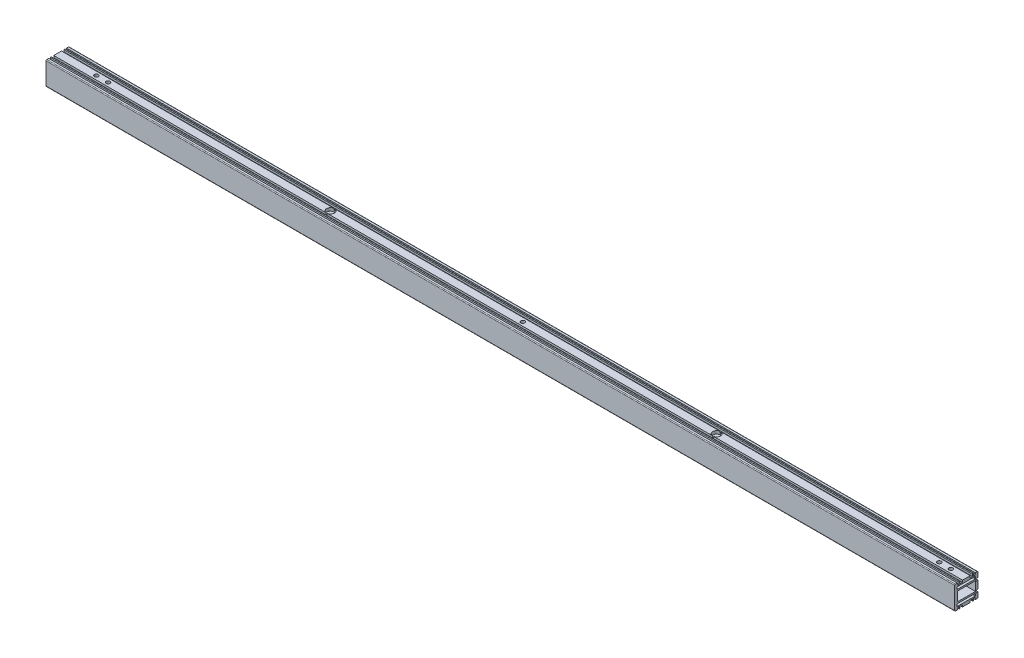
from build123d import *

# Parameters (mm, degrees)
SKETCH_1_W             = 23.5
SKETCH_1_H             = 12
EXTRUDE_1_DEPTH        = 586
HOLE_WIZARD_M6_1_D     = 5
HOLE_WIZARD_M6_1_DEPTH = 15
HOLE_WIZARD_M6_1_TIP   = 1.502151548
HOLE_WIZARD_M6_2_D     = 5
HOLE_WIZARD_M6_2_DEPTH = 15
HOLE_WIZARD_M6_2_TIP   = 1.502151548
HOLE_WIZARD_M6_3_D     = 5
HOLE_WIZARD_M6_3_DEPTH = 15
HOLE_WIZARD_M6_3_TIP   = 1.502151548
SKETCH_8_R             = 5.05
CUT_EXTRUDE_1_DEPTH    = 587.959112716
HOLE_WIZARD_M4_1_D     = 3.3
HOLE_WIZARD_M4_1_DEPTH = 10.1
HOLE_WIZARD_M4_1_TIP   = 0.991420021
HOLE_WIZARD_M4_2_D     = 3.3
HOLE_WIZARD_M4_2_DEPTH = 10.1
HOLE_WIZARD_M4_2_TIP   = 0.991420021
HOLE_WIZARD_M4_3_D     = 3.3
HOLE_WIZARD_M4_3_DEPTH = 10.1
HOLE_WIZARD_M4_3_TIP   = 0.991420021
HOLE_WIZARD_M6_4_D     = 5
HOLE_WIZARD_M6_4_DEPTH = 15
HOLE_WIZARD_M6_4_TIP   = 1.502151548


with BuildPart() as part:
    # 草图1 → 凸台-拉伸1 (new, symmetric)
    with BuildSketch(Plane(origin=(0, 0, 0), x_dir=(0, 0, -1), z_dir=(1, 0, 0))):
        with BuildLine():
            Line((-14, 15), (-11.5, 15))
            Line((-11.5, 15), (-11.5, 13.5))
            Line((-11.5, 13.5), (-11.4, 13.5))
            ThreePointArc((-11.4, 13.5), (-11.117157288, 13.382842712), (-11, 13.1))
            Line((-11, 13.1), (-11, 12))
            Line((-11, 12), (-9.5, 12))
            Line((-9.5, 12), (-9.5, 15))
            Line((-9.5, 15), (-8, 15))
            Line((-8, 15), (-8, 12.5))
            Line((-8, 12.5), (-5, 12.5))
            Line((-5, 12.5), (-5, 15))
            Line((-5, 15), (5, 15))
            Line((5, 15), (5, 12.5))
            Line((5, 12.5), (8, 12.5))
            Line((8, 12.5), (8, 15))
            Line((8, 15), (9.5, 15))
            Line((9.5, 15), (9.5, 12))
            Line((9.5, 12), (11, 12))
            Line((11, 12), (11, 13.1))
            ThreePointArc((11, 13.1), (11.117157288, 13.382842712), (11.4, 13.5))
            Line((11.4, 13.5), (11.5, 13.5))
            Line((11.5, 13.5), (11.5, 15))
            Line((11.5, 15), (14, 15))
            ThreePointArc((14, 15), (14.707106781, 14.707106781), (15, 14))
            Line((15, 14), (15, 8))
            Line((15, 8), (12.5, 8))
            Line((12.5, 8), (12.5, 5))
            Line((12.5, 5), (15, 5))
            Line((15, 5), (15, -5))
            Line((15, -5), (12.5, -5))
            Line((12.5, -5), (12.5, -8))
            Line((12.5, -8), (15, -8))
            Line((15, -8), (15, -14))
            ThreePointArc((15, -14), (14.707106781, -14.707106781), (14, -15))
            Line((14, -15), (11.5, -15))
            Line((11.5, -15), (11.5, -13.5))
            Line((11.5, -13.5), (11.4, -13.5))
            ThreePointArc((11.4, -13.5), (11.117157288, -13.382842712), (11, -13.1))
            Line((11, -13.1), (11, -12))
            Line((11, -12), (9.5, -12))
            Line((9.5, -12), (9.5, -15))
            Line((9.5, -15), (8, -15))
            Line((8, -15), (8, -12.5))
            Line((8, -12.5), (5, -12.5))
            Line((5, -12.5), (5, -15))
            Line((5, -15), (-5, -15))
            Line((-5, -15), (-5, -12.5))
            Line((-5, -12.5), (-8, -12.5))
            Line((-8, -12.5), (-8, -15))
            Line((-8, -15), (-9.5, -15))
            Line((-9.5, -15), (-9.5, -12))
            Line((-9.5, -12), (-11, -12))
            Line((-11, -12), (-11, -13.1))
            ThreePointArc((-11, -13.1), (-11.117157288, -13.382842712), (-11.4, -13.5))
            Line((-11.4, -13.5), (-11.5, -13.5))
            Line((-11.5, -13.5), (-11.5, -15))
            Line((-11.5, -15), (-14, -15))
            ThreePointArc((-14, -15), (-14.707106781, -14.707106781), (-15, -14))
            Line((-15, -14), (-15, 14))
            ThreePointArc((-15, 14), (-14.707106781, 14.707106781), (-14, 15))
        make_face()
        with BuildLine():
            Line((12, -10.5), (12, -8.5))
            ThreePointArc((12, -8.5), (11.853553391, -8.146446609), (11.5, -8))
            Line((11.5, -8), (-11.5, -8))
            ThreePointArc((-11.5, -8), (-11.853553391, -8.146446609), (-12, -8.5))
            Line((-12, -8.5), (-12, -10.5))
            ThreePointArc((-12, -10.5), (-11.853553391, -10.853553391), (-11.5, -11))
            Line((-11.5, -11), (11.5, -11))
            ThreePointArc((11.5, -11), (11.853553391, -10.853553391), (12, -10.5))
        make_face(mode=Mode.SUBTRACT)
        with BuildLine():
            Line((-11.5, 11), (11.5, 11))
            ThreePointArc((11.5, 11), (11.853553391, 10.853553391), (12, 10.5))
            Line((12, 10.5), (12, 8.5))
            ThreePointArc((12, 8.5), (11.853553391, 8.146446609), (11.5, 8))
            Line((11.5, 8), (-11.5, 8))
            ThreePointArc((-11.5, 8), (-11.853553391, 8.146446609), (-12, 8.5))
            Line((-12, 8.5), (-12, 10.5))
            ThreePointArc((-12, 10.5), (-11.853553391, 10.853553391), (-11.5, 11))
        make_face(mode=Mode.SUBTRACT)
        Rectangle(SKETCH_1_W, SKETCH_1_H, mode=Mode.SUBTRACT)
    extrude(amount=EXTRUDE_1_DEPTH, both=True)

    # M6 螺纹孔1
    with Locations(Plane(origin=(0, 15, 0), x_dir=(-1, 0, 0), z_dir=(0, 1, 0))):
        with Locations((-566, 0), (-551, 0), (521, 0), (536, 0), (-14, 0)):
            Hole(HOLE_WIZARD_M6_1_D / 2, depth=HOLE_WIZARD_M6_1_DEPTH)
            with Locations((0, 0, -(HOLE_WIZARD_M6_1_DEPTH + HOLE_WIZARD_M6_1_TIP / 2))):  # 118° drill point
                Cone(0, HOLE_WIZARD_M6_1_D / 2, HOLE_WIZARD_M6_1_TIP, mode=Mode.SUBTRACT)

    # M6 螺纹孔2
    with Locations(Plane(origin=(0, 0, -15), x_dir=(-1, 0, 0), z_dir=(0, 0, -1))):
        with Locations((536, 0), (521, 0), (-551, 0), (-566, 0), (448, 0), (361, 0), (344, 0)):
            Hole(HOLE_WIZARD_M6_2_D / 2, depth=HOLE_WIZARD_M6_2_DEPTH)
            with Locations((0, 0, -(HOLE_WIZARD_M6_2_DEPTH + HOLE_WIZARD_M6_2_TIP / 2))):  # 118° drill point
                Cone(0, HOLE_WIZARD_M6_2_D / 2, HOLE_WIZARD_M6_2_TIP, mode=Mode.SUBTRACT)

    # M6 螺纹孔3
    with Locations(Plane.XZ.offset(15)):
        with Locations((-199, 0), (-184, 0), (551, 0), (566, 0)):
            Hole(HOLE_WIZARD_M6_3_D / 2, depth=HOLE_WIZARD_M6_3_DEPTH)
            with Locations((0, 0, -(HOLE_WIZARD_M6_3_DEPTH + HOLE_WIZARD_M6_3_TIP / 2))):  # 118° drill point
                Cone(0, HOLE_WIZARD_M6_3_D / 2, HOLE_WIZARD_M6_3_TIP, mode=Mode.SUBTRACT)

    # 草图8 → 切除-拉伸1 (cut, through all)
    with BuildSketch(Plane(origin=(0, 15, 0), x_dir=(-1, 0, 0), z_dir=(0, 1, 0))):
        with Locations(Location((234, 0, 0), (0, 0, 90))):
            Circle(SKETCH_8_R)
        with Locations(Location((-264, 0, 0), (0, 0, 90))):
            Circle(SKETCH_8_R)
    extrude(amount=-CUT_EXTRUDE_1_DEPTH, mode=Mode.SUBTRACT)

    # M4 螺纹孔1
    with Locations(Plane.XZ.offset(15)):
        with Locations((-137, 0), (23, 0), (183, 0), (343, 0), (503, 0)):
            Hole(HOLE_WIZARD_M4_1_D / 2, depth=HOLE_WIZARD_M4_1_DEPTH)
            with Locations((0, 0, -(HOLE_WIZARD_M4_1_DEPTH + HOLE_WIZARD_M4_1_TIP / 2))):  # 118° drill point
                Cone(0, HOLE_WIZARD_M4_1_D / 2, HOLE_WIZARD_M4_1_TIP, mode=Mode.SUBTRACT)

    # M4 螺纹孔2
    with Locations(Plane.XZ.offset(15)):
        with Locations((-261, 0), (-461, 0)):
            Hole(HOLE_WIZARD_M4_2_D / 2, depth=HOLE_WIZARD_M4_2_DEPTH)
            with Locations((0, 0, -(HOLE_WIZARD_M4_2_DEPTH + HOLE_WIZARD_M4_2_TIP / 2))):  # 118° drill point
                Cone(0, HOLE_WIZARD_M4_2_D / 2, HOLE_WIZARD_M4_2_TIP, mode=Mode.SUBTRACT)

    # M4 螺纹孔3
    with Locations(Plane.XZ.offset(15)):
        with Locations((-571, 0), (-496, 0)):
            Hole(HOLE_WIZARD_M4_3_D / 2, depth=HOLE_WIZARD_M4_3_DEPTH)
            with Locations((0, 0, -(HOLE_WIZARD_M4_3_DEPTH + HOLE_WIZARD_M4_3_TIP / 2))):  # 118° drill point
                Cone(0, HOLE_WIZARD_M4_3_D / 2, HOLE_WIZARD_M4_3_TIP, mode=Mode.SUBTRACT)

    # M6 螺纹孔4
    with Locations(Plane(origin=(0, 0, -15), x_dir=(-1, 0, 0), z_dir=(0, 0, -1))):
        with Locations((326, 0), (266, 0), (-296, 0), (-356, 0)):
            Hole(HOLE_WIZARD_M6_4_D / 2, depth=HOLE_WIZARD_M6_4_DEPTH)
            with Locations((0, 0, -(HOLE_WIZARD_M6_4_DEPTH + HOLE_WIZARD_M6_4_TIP / 2))):  # 118° drill point
                Cone(0, HOLE_WIZARD_M6_4_D / 2, HOLE_WIZARD_M6_4_TIP, mode=Mode.SUBTRACT)


solid = part.part
